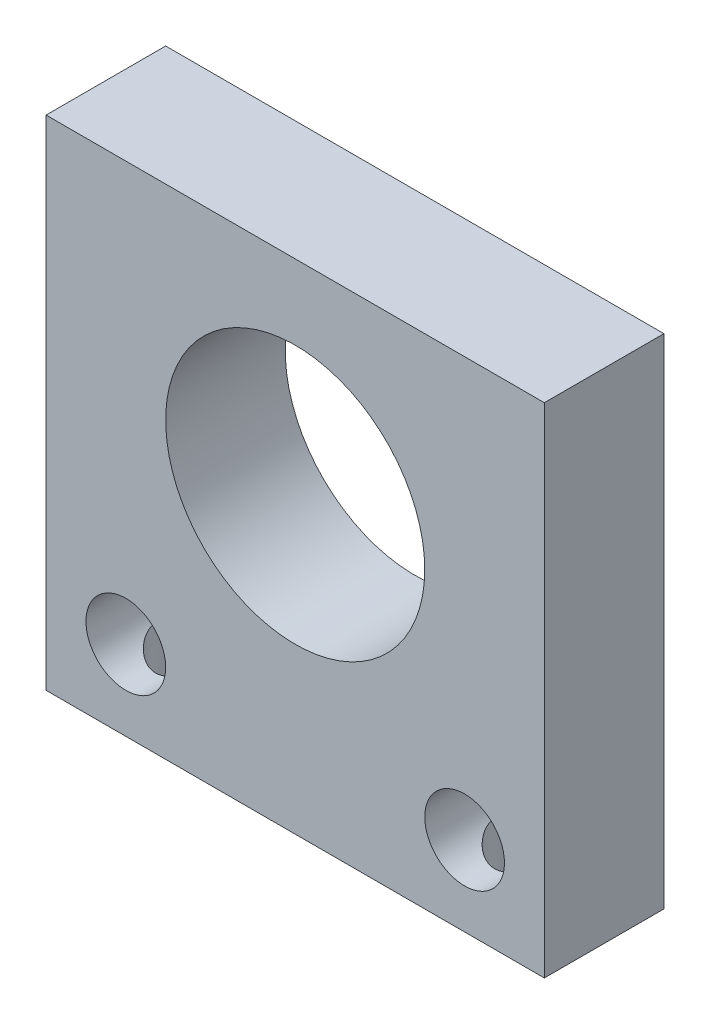
from build123d import *

# Parameters (mm, degrees)
SKETCH1_W           = 50
SKETCH1_H           = 50
BOSS_EXTRUDE1_DEPTH = 12
CUT_EXTRUDE1_REACH  = 39.336
SKETCH2_R           = 13
CUT_EXTRUDE2_REACH  = 39.336
SKETCH3_R           = 4
CUT_EXTRUDE3_REACH  = 59.175
SKETCH4_R           = 3


with BuildPart() as part:
    # Sketch1 → Boss-Extrude1 (new body)
    with BuildSketch(Plane.XY):
        Rectangle(SKETCH1_W, SKETCH1_H)
    extrude(amount=BOSS_EXTRUDE1_DEPTH)

    # Sketch2 → Cut-Extrude1 (cut, up to next)
    with BuildSketch(Plane.XY.offset(12), mode=Mode.PRIVATE) as cut_extrude1_sk1:
        with Locations((0, 4.5)):
            Circle(SKETCH2_R)
    cut_extrude1_tool1 = extrude(cut_extrude1_sk1.sketch, amount=-CUT_EXTRUDE1_REACH, mode=Mode.PRIVATE) & part.part
    add(cut_extrude1_tool1.solids().sort_by_distance((0, 4.5, 12))[0], mode=Mode.SUBTRACT)

    # Sketch3 → Cut-Extrude2 (cut, up to next)
    with BuildSketch(Plane.XY.offset(12), mode=Mode.PRIVATE) as cut_extrude2_sk1:
        with Locations((-17, -17)):
            Circle(SKETCH3_R)
    cut_extrude2_tool1 = extrude(cut_extrude2_sk1.sketch, amount=-CUT_EXTRUDE2_REACH, mode=Mode.PRIVATE) & part.part
    # Sketch3 → Cut-Extrude2 (cut, up to next)
    with BuildSketch(Plane.XY.offset(12), mode=Mode.PRIVATE) as cut_extrude2_sk2:
        with Locations((17, -17)):
            Circle(SKETCH3_R)
    cut_extrude2_tool2 = extrude(cut_extrude2_sk2.sketch, amount=-CUT_EXTRUDE2_REACH, mode=Mode.PRIVATE) & part.part
    add(cut_extrude2_tool1.solids().sort_by_distance((-17, -17, 12))[0], mode=Mode.SUBTRACT)
    add(cut_extrude2_tool2.solids().sort_by_distance((17, -17, 12))[0], mode=Mode.SUBTRACT)

    # Sketch4 → Cut-Extrude3 (cut, up to next)
    with BuildSketch(Plane.XZ.offset(25), mode=Mode.PRIVATE) as cut_extrude3_sk1:
        with Locations(Location((17, 6, 0), (0, 0, 270))):
            Circle(SKETCH4_R)
    cut_extrude3_tool1 = extrude(cut_extrude3_sk1.sketch, amount=-CUT_EXTRUDE3_REACH, mode=Mode.PRIVATE) & part.part
    # Sketch4 → Cut-Extrude3 (cut, up to next)
    with BuildSketch(Plane.XZ.offset(25), mode=Mode.PRIVATE) as cut_extrude3_sk2:
        with Locations(Location((-17, 6, 0), (0, 0, 270))):
            Circle(SKETCH4_R)
    cut_extrude3_tool2 = extrude(cut_extrude3_sk2.sketch, amount=-CUT_EXTRUDE3_REACH, mode=Mode.PRIVATE) & part.part
    add(cut_extrude3_tool1.solids().sort_by_distance((17, -25, 6))[0], mode=Mode.SUBTRACT)
    add(cut_extrude3_tool2.solids().sort_by_distance((-17, -25, 6))[0], mode=Mode.SUBTRACT)


solid = part.part
